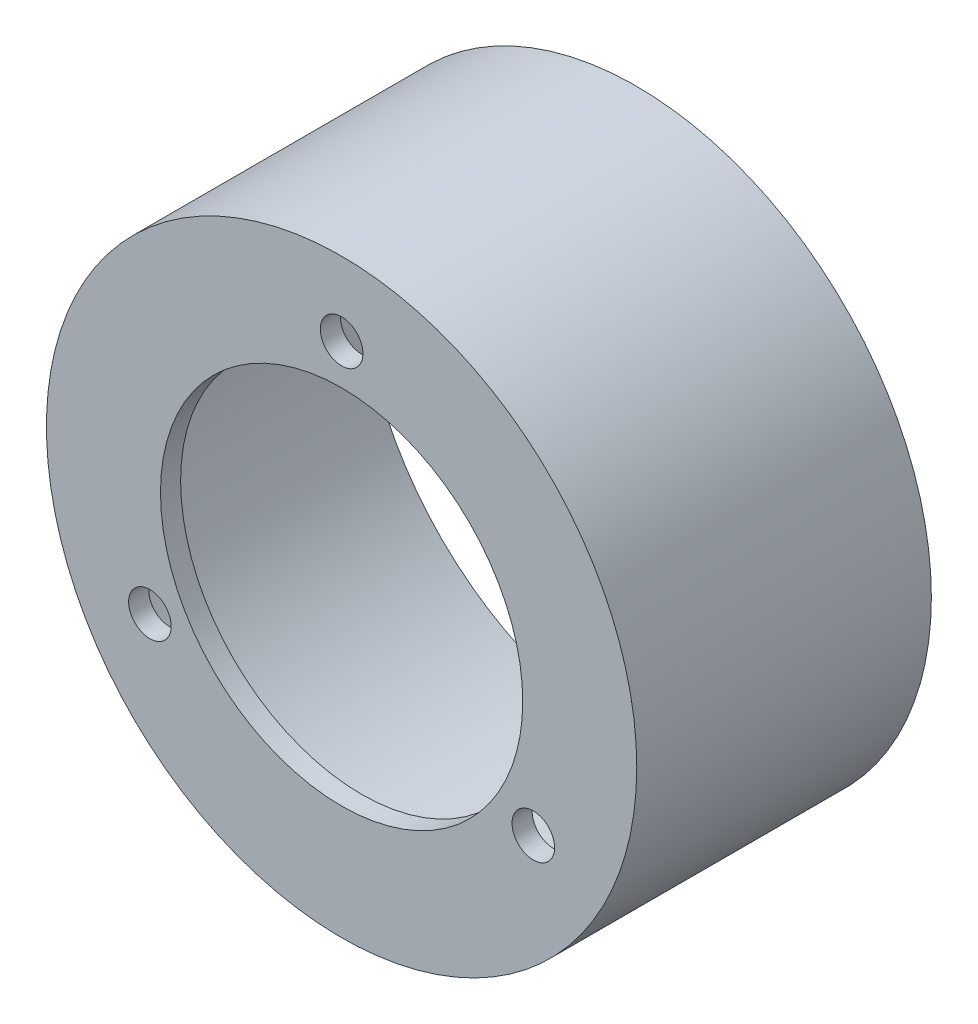
from build123d import *

# Parameters (mm, degrees)
SKETCH1_R           = 20.5
SKETCH1_R_2         = 1.5875
SKETCH1_R_3         = 13.5
EXTRUDE1_DEPTH      = 1.5
BOSS_EXTRUDE1_START = -21.9577
SKETCH2_R           = 22
SKETCH2_R_2         = 20.5
BOSS_EXTRUDE1_DEPTH = 21.9577


with BuildPart() as part:
    # Sketch1 → Extrude1 (new body)
    # profile 1 of 4: a face of its own
    with BuildSketch(Plane.XY):
        Circle(SKETCH1_R)
        with Locations((-14.289419162, 8.25)):
            Circle(SKETCH1_R_2, mode=Mode.SUBTRACT)
        with Locations((0, -16.5)):
            Circle(SKETCH1_R_2, mode=Mode.SUBTRACT)
        with Locations((14.289419162, 8.25)):
            Circle(SKETCH1_R_2, mode=Mode.SUBTRACT)
        with Locations((-14.289419162, -8.25)):
            Circle(SKETCH1_R_2, mode=Mode.SUBTRACT)
        with Locations((14.289419162, -8.25)):
            Circle(SKETCH1_R_2, mode=Mode.SUBTRACT)
        with Locations((0, 16.5)):
            Circle(SKETCH1_R_2, mode=Mode.SUBTRACT)
        Circle(SKETCH1_R_3, mode=Mode.SUBTRACT)
    # profile 2 of 4: a face of its own
    with BuildSketch(Plane.XY):
        with Locations((-14.289419162, 8.25)):
            Circle(SKETCH1_R_2)
    # profile 3 of 4: a face of its own
    with BuildSketch(Plane.XY):
        with Locations((14.289419162, 8.25)):
            Circle(SKETCH1_R_2)
    # profile 4 of 4: a face of its own
    with BuildSketch(Plane.XY):
        with Locations((0, -16.5)):
            Circle(SKETCH1_R_2)
    extrude(amount=EXTRUDE1_DEPTH)

    # Sketch2 → Boss-Extrude1 (add)
    with BuildSketch(Plane.XY.offset(1.5).offset(BOSS_EXTRUDE1_START)):
        Circle(SKETCH2_R)
        Circle(SKETCH2_R_2, mode=Mode.SUBTRACT)
    extrude(amount=BOSS_EXTRUDE1_DEPTH)


solid = part.part
